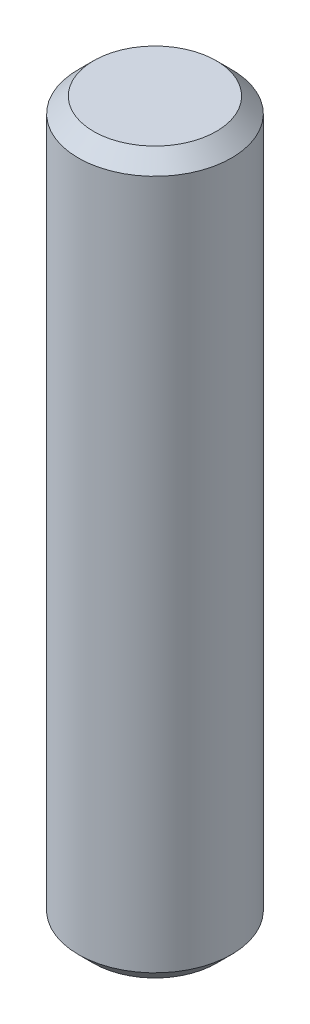
from build123d import *

# Parameters (mm, degrees)
SKETCH1_R           = 0.5
BOSS_EXTRUDE1_DEPTH = 4.7
CHAMFER1_SIZE       = 0.1


with BuildPart() as part:
    # Sketch1 → Boss-Extrude1 (new body)
    with BuildSketch(Plane(origin=(0, 0, 0), x_dir=(1, 0, 0), z_dir=(0, 1, 0))):
        with Locations(Location((0, 0, 0), (0, 0, 270))):
            Circle(SKETCH1_R)
    extrude(amount=BOSS_EXTRUDE1_DEPTH)

    # Chamfer1
    chamfer1_edges = [part.edges().sort_by_distance(p)[0] for p in [
        (0, 0, -0.5),
        (0, 4.7, -0.5),
    ]]
    chamfer(chamfer1_edges, length=CHAMFER1_SIZE)


solid = part.part
